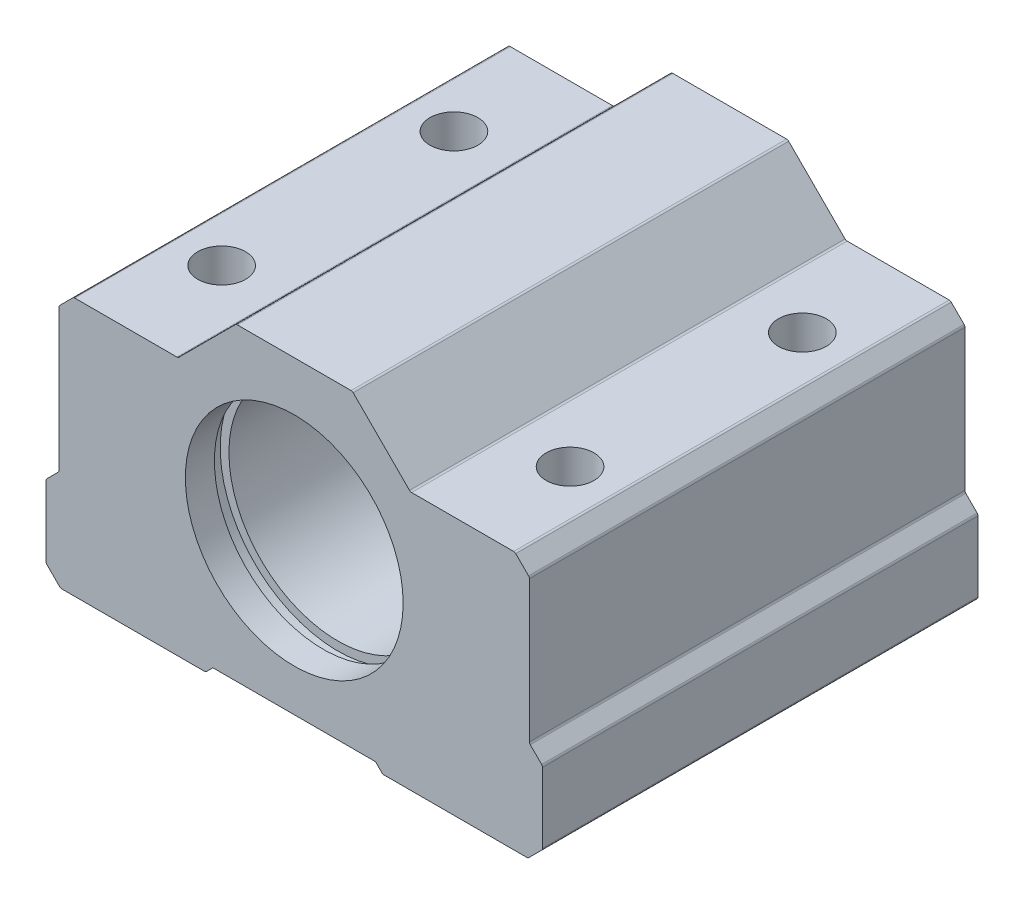
from build123d import *

# Parameters (mm, degrees)
ESQUISSE1_R             = 7.5
BOSS_EXTRU_1_DEPTH      = 15
CHANFREIN1_SIZE         = 1
CONG_1_R                = 0.2
ESQUISSE2_R             = 8.1
ENL_V_MAT_EXTRU_1_DEPTH = 1
ENL_V_START             = -1
ESQUISSE3_R             = 8.1
ENL_V_MAT_EXTRU_2_DEPTH = 1
TROU_TARAUD_M41_D       = 3.3


with BuildPart() as part:
    # Esquisse1 → Boss.-Extru.1 (new, symmetric)
    with BuildSketch(Plane.XY):
        Polygon((5.6, 0.5), (-5.6, 0.5), (-6.1, 0), (-17.1, 0), (-17.1, 6), (-16.2, 6.9), (-16.2, 17.8), (-8, 17.8), (-4, 21.8), (4, 21.8), (8, 17.8), (16.2, 17.8), (16.2, 6.9), (17.1, 6), (17.1, 0), (6.1, 0), align=None)
        with Locations((0, 10.9)):
            Circle(ESQUISSE1_R, mode=Mode.SUBTRACT)
    extrude(amount=BOSS_EXTRU_1_DEPTH, both=True)

    # Chanfrein1
    chanfrein1_edges = [part.edges().sort_by_distance(p)[0] for p in [
        (-17.1, 0, 0),
        (-16.2, 17.8, 0),
        (16.2, 17.8, 0),
        (17.1, 0, 0),
    ]]
    chamfer(chanfrein1_edges, length=CHANFREIN1_SIZE)

    # Congé1
    cong_1_edges = [part.edges().sort_by_distance(p)[0] for p in [
        (6.1, 0, 0),
        (5.6, 0.5, 0),
        (-5.6, 0.5, 0),
        (-6.1, 0, 0),
        (-17.1, 6, 0),
        (-16.2, 6.9, 0),
        (-8, 17.8, 0),
        (-4, 21.8, 0),
        (4, 21.8, 0),
        (8, 17.8, 0),
        (16.2, 6.9, 0),
        (17.1, 6, 0),
        (17.1, 1, 0),
        (16.1, 0, 0),
        (-16.1, 0, 0),
        (-17.1, 1, 0),
        (-16.2, 16.8, 0),
        (-15.2, 17.8, 0),
        (15.2, 17.8, 0),
        (16.2, 16.8, 0),
    ]]
    fillet(cong_1_edges, radius=CONG_1_R)

    # Esquisse2 → Enlèv. mat.-Extru.1 (cut)
    with BuildSketch(Plane.XY.offset(13)):
        with Locations((0, 10.9)):
            Circle(ESQUISSE2_R)
    extrude(amount=-ENL_V_MAT_EXTRU_1_DEPTH, mode=Mode.SUBTRACT)

    # Esquisse3 → Enlèv. mat.-Extru.2 (cut)
    with BuildSketch(Plane(origin=(0, 0, -13), x_dir=(-1, 0, 0), z_dir=(0, 0, -1)).offset(ENL_V_START)):
        with Locations(Location((0, 10.9, 0), (0, 0, 180))):
            Circle(ESQUISSE3_R)
    extrude(amount=ENL_V_MAT_EXTRU_2_DEPTH, mode=Mode.SUBTRACT)

    # Trou taraudé M41 (through all)
    with Locations(Plane(origin=(0, 0, 0), x_dir=(-1, 0, 0), z_dir=(0, -1, 0))):
        with Locations((-12, -8), (12, -8), (12, 8), (-12, 8)):
            Hole(TROU_TARAUD_M41_D / 2)


solid = part.part
